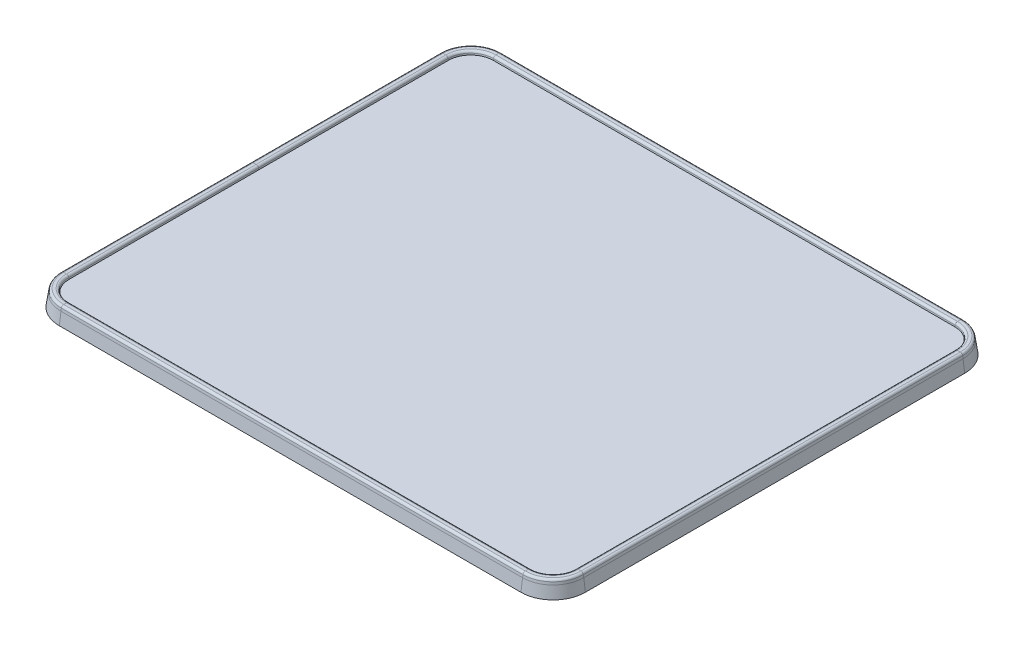
from build123d import *

# Parameters (mm, degrees)
BOSS_EXTRUDE1_START = 1.27
BOSS_EXTRUDE1_DEPTH = 1.27


with BuildPart() as part:
    # Sweep1: sweep along a path in Sketch2
    with BuildLine(Plane(origin=(0, 428.625, 0), x_dir=(1, 0, 0), z_dir=(0, 1, 0))) as sweep1_path:
        Line((-249.2375, -230.1875), (249.2375, -230.1875))
        ThreePointArc((249.2375, -230.1875), (267.198012242, -222.748012242), (274.6375, -204.7875))
        Line((274.6375, -204.7875), (274.6375, 204.7875))
        ThreePointArc((274.6375, 204.7875), (267.198012242, 222.748012242), (249.2375, 230.1875))
        Line((249.2375, 230.1875), (-249.2375, 230.1875))
        ThreePointArc((-249.2375, 230.1875), (-267.198012242, 222.748012242), (-274.6375, 204.7875))
        Line((-274.6375, 204.7875), (-274.6375, -204.7875))
        ThreePointArc((-274.6375, -204.7875), (-267.198012242, -222.748012242), (-249.2375, -230.1875))
    # Sketch3 → Sweep1 (sweep)
    with BuildSketch(Plane.XY):
        with BuildLine():
            Line((-274.6375, 428.625), (-275.02653488, 431.318318399))
            ThreePointArc((-275.02653488, 431.318318399), (-275.452129987, 432.096831513), (-276.283489893, 432.406758231))
            Line((-276.283489893, 432.406758231), (-279.341510107, 432.406758231))
            ThreePointArc((-279.341510107, 432.406758231), (-280.172870013, 432.096831513), (-280.59846512, 431.318318399))
            Line((-280.59846512, 431.318318399), (-280.9875, 428.625))
            Line((-280.9875, 428.625), (-282.821944444, 415.925))
            Line((-282.821944444, 415.925), (-284.078899458, 416.106560169))
            Line((-284.078899458, 416.106560169), (-282.244455013, 428.806560169))
            Line((-282.244455013, 428.806560169), (-281.855420133, 431.499878568))
            ThreePointArc((-281.855420133, 431.499878568), (-281.004229918, 433.056904795), (-279.341510107, 433.676758231))
            Line((-279.341510107, 433.676758231), (-276.283489893, 433.676758231))
            ThreePointArc((-276.283489893, 433.676758231), (-274.620770082, 433.056904795), (-273.769579867, 431.499878568))
            Line((-273.769579867, 431.499878568), (-273.537764074, 429.895))
            Line((-273.537764074, 429.895), (-273.537764074, 428.625))
            Line((-273.537764074, 428.625), (-274.6375, 428.625))
        make_face()
    sweep(path=sweep1_path.line)

    # Sketch6 → Boss-Extrude1 (add)
    with BuildSketch(Plane(origin=(0, 428.625, 0), x_dir=(1, 0, 0), z_dir=(0, 1, 0)).offset(BOSS_EXTRUDE1_START)):
        with BuildLine():
            Line((249.2375, 229.087764074), (-249.2375, 229.087764074))
            ThreePointArc((-249.2375, 229.087764074), (-266.420381511, 221.970381511), (-273.537764074, 204.7875))
            Line((-273.537764074, 204.7875), (-273.537764074, 0))
            Line((-273.537764074, 0), (-273.537764074, -204.7875))
            ThreePointArc((-273.537764074, -204.7875), (-266.420381511, -221.970381511), (-249.2375, -229.087764074))
            Line((-249.2375, -229.087764074), (249.2375, -229.087764074))
            ThreePointArc((249.2375, -229.087764074), (266.420381511, -221.970381511), (273.537764074, -204.7875))
            Line((273.537764074, -204.7875), (273.537764074, 204.7875))
            ThreePointArc((273.537764074, 204.7875), (266.420381511, 221.970381511), (249.2375, 229.087764074))
        make_face()
    extrude(amount=-BOSS_EXTRUDE1_DEPTH)


solid = part.part
